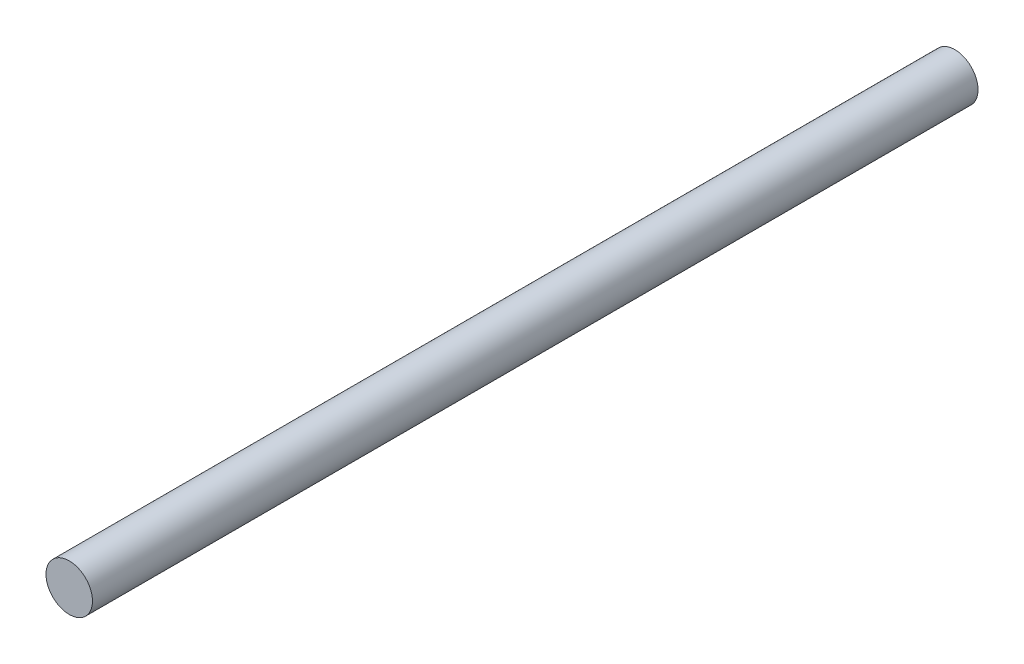
from build123d import *

# Parameters (mm, degrees)
SKETCH1_R           = 2
BOSS_EXTRUDE1_DEPTH = 76.2


with BuildPart() as part:
    # Sketch1 → Boss-Extrude1 (new body)
    with BuildSketch(Plane.XY):
        with Locations(Location((0, 0, 0), (0, 0, 180))):
            Circle(SKETCH1_R)
    extrude(amount=BOSS_EXTRUDE1_DEPTH)


solid = part.part
